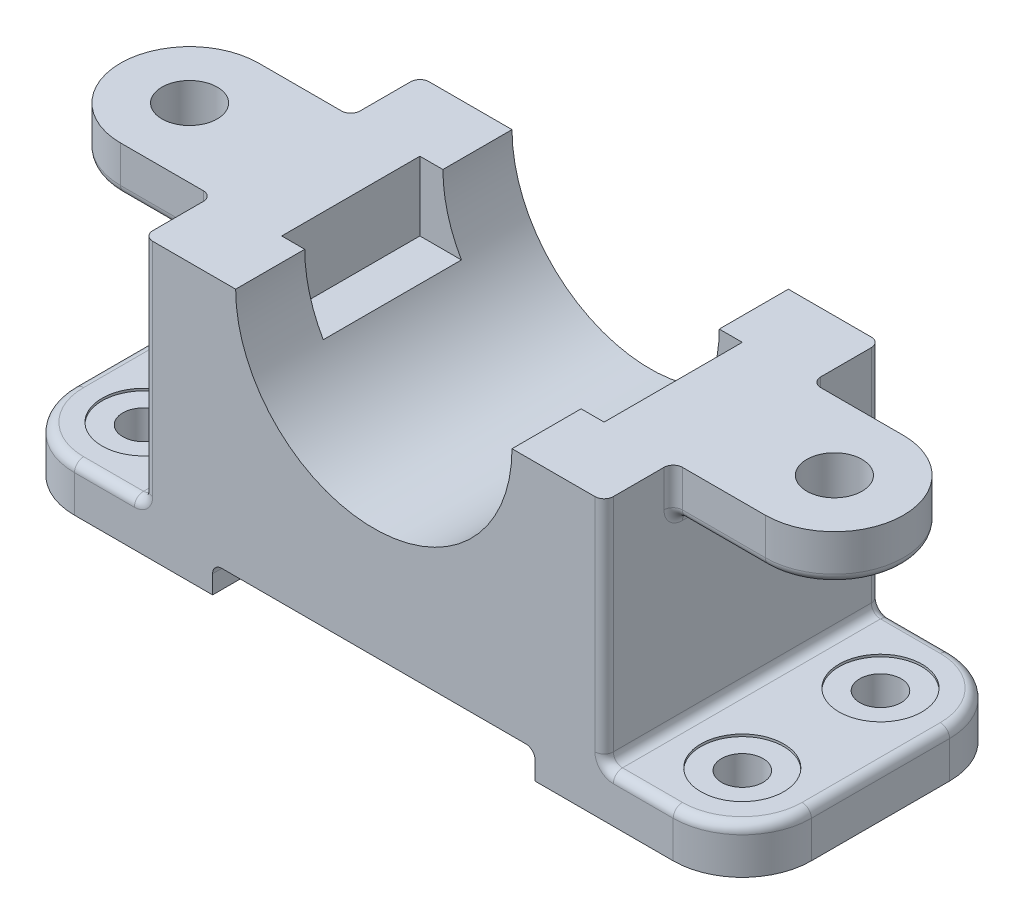
from build123d import *

# Parameters (mm, degrees)
SKETCH_1_W                   = 160
SKETCH_1_H                   = 60
EXTRUDE_1_DEPTH              = 60
SKETCH_2_W                   = 30
SKETCH_2_H                   = 50
CUT_EXTRUDE_1_DEPTH          = 114.648581161
SKETCH_3_W                   = 30
SKETCH_3_H                   = 50
CUT_EXTRUDE_2_DEPTH          = 114.648581161
SKETCH_4_W                   = 69.99999994
SKETCH_4_H                   = 6
CUT_EXTRUDE_3_DEPTH          = 114.648581161
EXTRUDE_2_DEPTH              = 10
EXTRUDE_3_DEPTH              = 10
SKETCH_7_W                   = 70.000000048
SKETCH_7_H                   = 30
CUT_EXTRUDE_4_DEPTH          = 15
HOLE_WIZARD_M52_1_D          = 60
HOLE_WIZARD_12_0_12_1_D      = 12
HOLE_WIZARD_12_0_12_1_DEPTH  = 10
HOLE_WIZARD_12_0_12_2_D      = 12
HOLE_WIZARD_12_0_12_2_DEPTH  = 10
HOLE_WIZARD_M8_1_D           = 9
HOLE_WIZARD_M8_1_DEPTH       = 10
HOLE_WIZARD_M8_1_CBORE_D     = 18
HOLE_WIZARD_M8_1_CBORE_DEPTH = 0.5
FILLET_1_R                   = 15
FILLET_2_R                   = 2


with BuildPart() as part:
    # 草图1 → 凸台-拉伸1 (new body)
    with BuildSketch(Plane(origin=(0, 54, 0), x_dir=(1, 0, 0), z_dir=(0, 1, 0))):
        Rectangle(SKETCH_1_W, SKETCH_1_H)
    extrude(amount=-EXTRUDE_1_DEPTH)

    # 草图2 → 切除-拉伸1 (cut, through all)
    with BuildSketch(Plane(origin=(0, 0, -30), x_dir=(-1, 0, 0), z_dir=(0, 0, -1))):
        with Locations((-65, 29)):
            Rectangle(SKETCH_2_W, SKETCH_2_H)
    extrude(amount=-CUT_EXTRUDE_1_DEPTH, mode=Mode.SUBTRACT)

    # 草图3 → 切除-拉伸2 (cut, through all)
    with BuildSketch(Plane(origin=(0, 0, -30), x_dir=(-1, 0, 0), z_dir=(0, 0, -1))):
        with Locations((65, 29)):
            Rectangle(SKETCH_3_W, SKETCH_3_H)
    extrude(amount=-CUT_EXTRUDE_2_DEPTH, mode=Mode.SUBTRACT)

    # 草图4 → 切除-拉伸3 (cut, through all)
    with BuildSketch(Plane(origin=(0, 0, -30), x_dir=(-1, 0, 0), z_dir=(0, 0, -1))):
        with Locations((0, -3)):
            Rectangle(SKETCH_4_W, SKETCH_4_H)
    extrude(amount=-CUT_EXTRUDE_3_DEPTH, mode=Mode.SUBTRACT)

    # 草图5 → 凸台-拉伸2 (add)
    with BuildSketch(Plane(origin=(0, 54, 0), x_dir=(1, 0, 0), z_dir=(0, 1, 0))):
        with BuildLine():
            Line((-50, -15), (-50, 15))
            Line((-50, 15), (-70, 15))
            ThreePointArc((-70, 15), (-85, 0), (-70, -15))
            Line((-70, -15), (-50, -15))
        make_face()
    extrude(amount=-EXTRUDE_2_DEPTH)

    # 草图6 → 凸台-拉伸3 (add)
    with BuildSketch(Plane(origin=(0, 54, 0), x_dir=(1, 0, 0), z_dir=(0, 1, 0))):
        with BuildLine():
            Line((50, 15), (50, -15))
            Line((50, -15), (70, -15))
            ThreePointArc((70, -15), (85, 0), (70, 15))
            Line((70, 15), (50, 15))
        make_face()
    extrude(amount=-EXTRUDE_3_DEPTH)

    # 草图7 → 切除-拉伸4 (cut)
    with BuildSketch(Plane(origin=(0, 54, 0), x_dir=(-1, 0, 0), z_dir=(0, 1, 0))):
        Rectangle(SKETCH_7_W, SKETCH_7_H)
    extrude(amount=-CUT_EXTRUDE_4_DEPTH, mode=Mode.SUBTRACT)

    # M52 间隙孔1 (through all)
    with Locations(Plane(origin=(0, 0, -30), x_dir=(-1, 0, 0), z_dir=(0, 0, -1))):
        with Locations((0, 54)):
            Hole(HOLE_WIZARD_M52_1_D / 2)

    # Ø12.0 (12) 直径孔1
    with Locations(Plane(origin=(0, 44, 0), x_dir=(-1, 0, 0), z_dir=(0, -1, 0))):
        with Locations((-70, 0)):
            Hole(HOLE_WIZARD_12_0_12_1_D / 2, depth=HOLE_WIZARD_12_0_12_1_DEPTH)

    # Ø12.0 (12) 直径孔2
    with Locations(Plane(origin=(0, 54, 0), x_dir=(1, 0, 0), z_dir=(0, 1, 0))):
        with Locations((-70, 0)):
            Hole(HOLE_WIZARD_12_0_12_2_D / 2, depth=HOLE_WIZARD_12_0_12_2_DEPTH)

    # M8 六角头螺栓的柱形沉头孔1
    with Locations(Plane(origin=(0, 4, 0), x_dir=(1, 0, 0), z_dir=(0, 1, 0))):
        with Locations((-65, -15), (-65, 15), (65, 15), (65, -15)):
            CounterBoreHole(HOLE_WIZARD_M8_1_D / 2, HOLE_WIZARD_M8_1_CBORE_D / 2, HOLE_WIZARD_M8_1_CBORE_DEPTH, depth=HOLE_WIZARD_M8_1_DEPTH)

    # 圆角1
    fillet_1_edges = [part.edges().sort_by_distance(p)[0] for p in [
        (80, -1, 30),
        (-80, -1, 30),
        (-80, -1, -30),
        (80, -1, -30),
    ]]
    fillet(fillet_1_edges, radius=FILLET_1_R)

    # 圆角2
    fillet_2_edges = [part.edges().sort_by_distance(p)[0] for p in [
        (80, 4, 0),
        (57.5, 4, -30),
        (57.5, 4, 30),
        (75.606601718, 4, 25.606601718),
        (75.606601718, 4, -25.606601718),
        (-80, 4, 0),
        (-75.606601718, 4, 25.606601718),
        (-75.606601718, 4, -25.606601718),
        (50, 4, 0),
        (50, 29, 30),
        (50, 29, -30),
        (-57.5, 4, 30),
        (-50, 29, 30),
        (-50, 4, 0),
        (-50, 29, -30),
        (-57.5, 4, -30),
        (34.99999997, 0, 0),
        (-34.99999997, 0, 0),
        (-60, 44, 15),
        (-50, 49, 15),
        (-85, 44, 0),
        (-60, 44, -15),
        (-50, 44, 0),
        (-50, 49, -15),
        (60, 44, -15),
        (50, 49, -15),
        (85, 44, 0),
        (60, 44, 15),
        (50, 44, 0),
        (50, 49, 15),
    ]]
    fillet(fillet_2_edges, radius=FILLET_2_R)


solid = part.part
